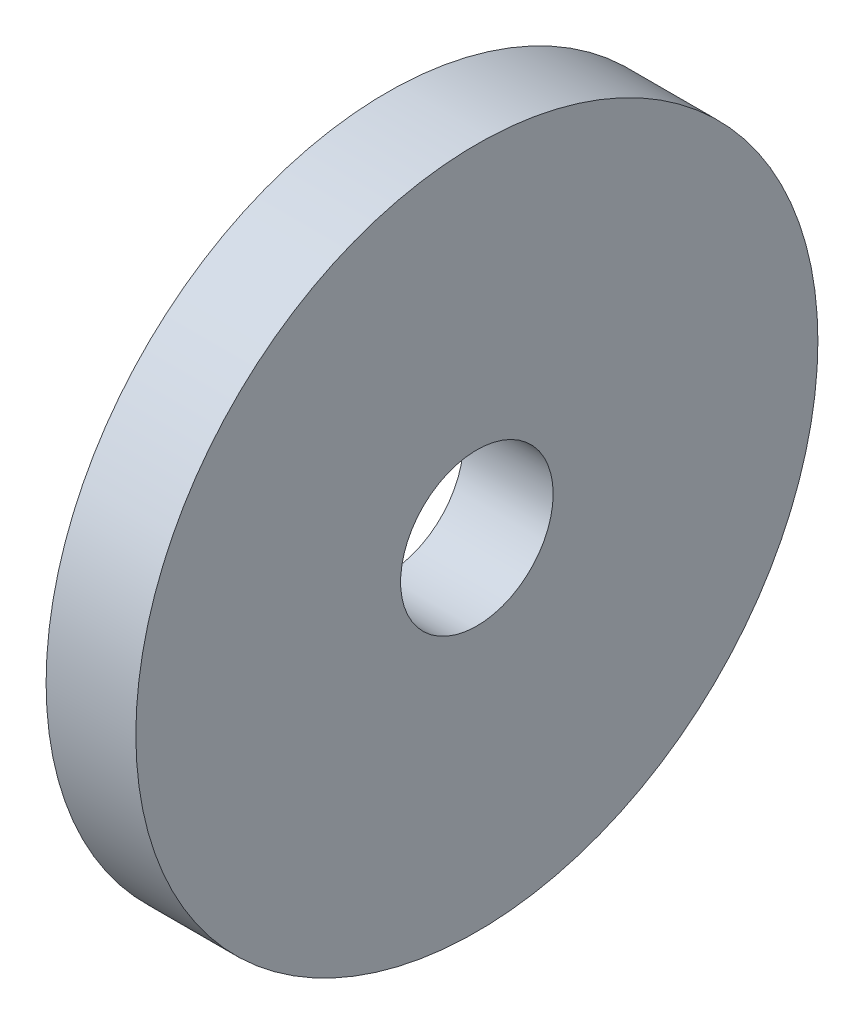
from build123d import *

# Parameters (mm, degrees)
SKETCH1_R           = 19
SKETCH1_R_2         = 4.25
BOSS_EXTRUDE1_DEPTH = 5


with BuildPart() as part:
    # Sketch1 → Boss-Extrude1 (new body)
    with BuildSketch(Plane(origin=(0, 0, 0), x_dir=(0, 0, -1), z_dir=(1, 0, 0))):
        Circle(SKETCH1_R)
        Circle(SKETCH1_R_2, mode=Mode.SUBTRACT)
    extrude(amount=BOSS_EXTRUDE1_DEPTH)


solid = part.part
